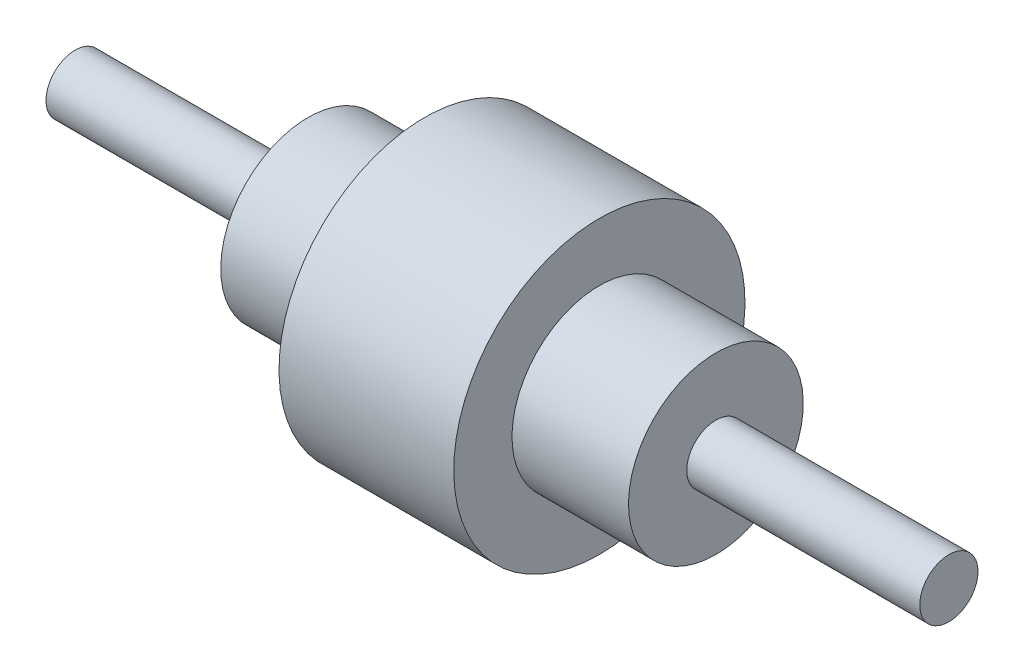
from build123d import *


with BuildPart() as part:
    # Sketch1 → Revolve5 (revolve)
    with BuildSketch(Plane.XY, mode=Mode.PRIVATE) as revolve5_sk:
        Polygon((-30, 50), (30, 50), (30, 30), (70, 30), (70, 10), (150, 10), (150, 0), (-150, 0), (-150, 10), (-70, 10), (-70, 30), (-30, 30), align=None)
    revolve(revolve5_sk.sketch.rotate(Axis((-150, 0, 0), (1, 0, 0)), 180), axis=Axis((-150, 0, 0), (1, 0, 0)))


solid = part.part
